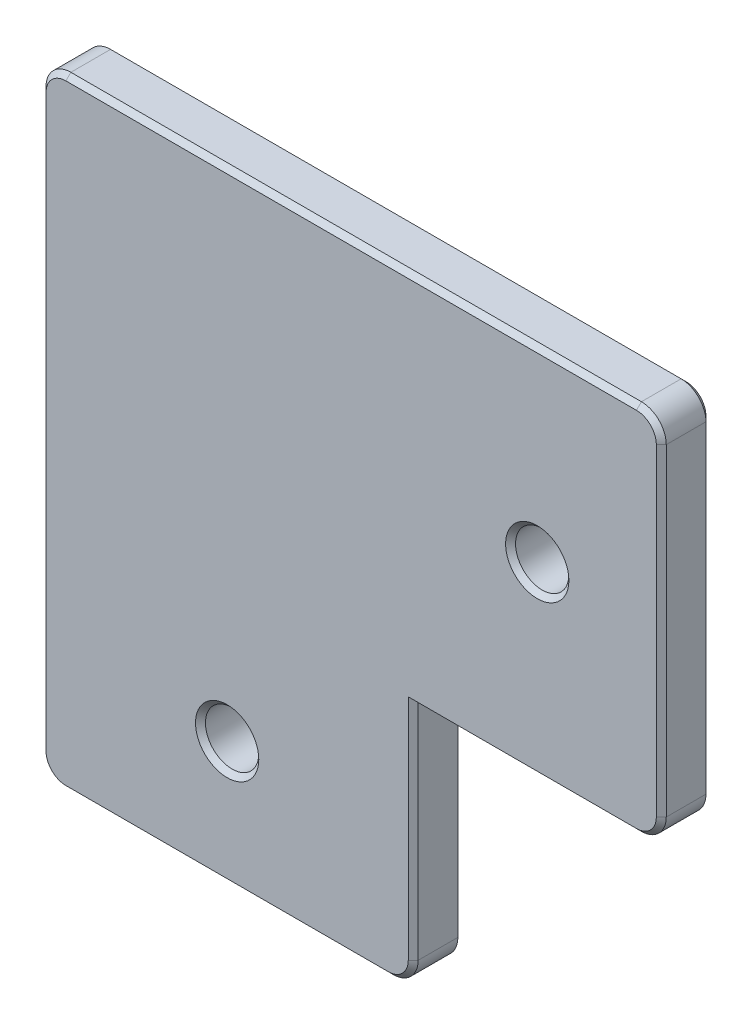
from build123d import *

# Parameters (mm, degrees)
SKETCH1_R           = 2.15
BOSS_EXTRUDE1_DEPTH = 4
FILLET1_R           = 2
CHAMFER1_SIZE       = 0.4


with BuildPart() as part:
    # Sketch1 → Boss-Extrude1 (new body)
    with BuildSketch(Plane.XY):
        Polygon((0, -50), (30, -50), (30, -30), (50, -30), (50, 0), (0, 0), align=None)
        with Locations((15, -40)):
            Circle(SKETCH1_R, mode=Mode.SUBTRACT)
        with Locations((40, -15)):
            Circle(SKETCH1_R, mode=Mode.SUBTRACT)
    extrude(amount=BOSS_EXTRUDE1_DEPTH)

    # Fillet1
    fillet1_edges = [part.edges().sort_by_distance(p)[0] for p in [
        (0, 0, 2),
        (50, 0, 2),
        (50, -30, 2),
        (30, -50, 2),
        (0, -50, 2),
    ]]
    fillet(fillet1_edges, radius=FILLET1_R)

    # Chamfer1
    chamfer1_edges = [part.edges().sort_by_distance(p)[0] for p in [
        (39, -30, 4),
        (12.85, -40, 0),
        (12.85, -40, 4),
        (37.85, -15, 0),
        (37.85, -15, 4),
        (0, -25, 0),
        (0, -25, 4),
        (25, 0, 0),
        (50, -15, 0),
        (30, -39, 0),
        (15, -50, 0),
        (29.414213562, -49.414213562, 0),
        (0.585786438, -49.414213562, 0),
        (49.414213562, -29.414213562, 0),
        (49.414213562, -0.585786438, 0),
        (0.585786438, -0.585786438, 0),
        (25, 0, 4),
        (15, -50, 4),
        (30, -39, 4),
        (50, -15, 4),
        (29.414213562, -49.414213562, 4),
        (0.585786438, -49.414213562, 4),
        (49.414213562, -29.414213562, 4),
        (49.414213562, -0.585786438, 4),
        (0.585786438, -0.585786438, 4),
        (39, -30, 0),
    ]]
    chamfer(chamfer1_edges, length=CHAMFER1_SIZE)


solid = part.part
